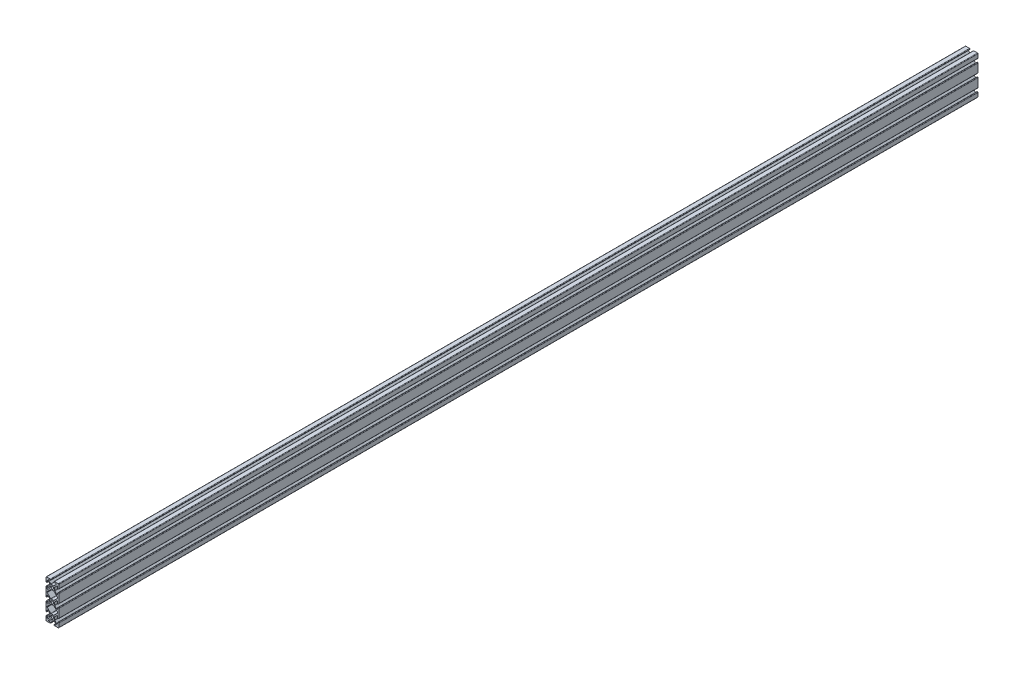
from build123d import *

# Parameters (mm, degrees)
SKETCH1_R            = 2.6035
MAIN_EXTRUSION_DEPTH = 914.4


with BuildPart() as part:
    # Sketch1 → Main Extrusion (new, symmetric)
    with BuildSketch(Plane.XY):
        with BuildLine():
            Line((-12.7, 37.084), (-12.7, 29.6672))
            ThreePointArc((-12.7, 29.6672), (-12.40242049, 28.94877951), (-11.684, 28.6512))
            Line((-11.684, 28.6512), (-11.5062, 28.6512))
            ThreePointArc((-11.5062, 28.6512), (-10.78777951, 28.94877951), (-10.4902, 29.6672))
            Line((-10.4902, 29.6672), (-10.4902, 31.874794456))
            ThreePointArc((-10.4902, 31.874794456), (-9.863006367, 32.813456061), (-8.75577951, 32.593214945))
            Line((-8.75577951, 32.593214945), (-4.81877951, 28.656214945))
            ThreePointArc((-4.81877951, 28.656214945), (-4.598538395, 28.326600823), (-4.5212, 27.937794456))
            Line((-4.5212, 27.937794456), (-4.5212, 22.862205544))
            ThreePointArc((-4.5212, 22.862205544), (-4.598538395, 22.473399177), (-4.81877951, 22.143785055))
            Line((-4.81877951, 22.143785055), (-8.75577951, 18.206785055))
            ThreePointArc((-8.75577951, 18.206785055), (-9.863006367, 17.986543939), (-10.4902, 18.925205544))
            Line((-10.4902, 18.925205544), (-10.4902, 21.1328))
            ThreePointArc((-10.4902, 21.1328), (-10.78777951, 21.85122049), (-11.5062, 22.1488))
            Line((-11.5062, 22.1488), (-11.684, 22.1488))
            ThreePointArc((-11.684, 22.1488), (-12.40242049, 21.85122049), (-12.7, 21.1328))
            Line((-12.7, 21.1328), (-12.7, 4.2672))
            ThreePointArc((-12.7, 4.2672), (-12.40242049, 3.54877951), (-11.684, 3.2512))
            Line((-11.684, 3.2512), (-11.5062, 3.2512))
            ThreePointArc((-11.5062, 3.2512), (-10.78777951, 3.54877951), (-10.4902, 4.2672))
            Line((-10.4902, 4.2672), (-10.4902, 6.474794456))
            ThreePointArc((-10.4902, 6.474794456), (-9.863006367, 7.413456061), (-8.75577951, 7.193214945))
            Line((-8.75577951, 7.193214945), (-4.81877951, 3.256214945))
            ThreePointArc((-4.81877951, 3.256214945), (-4.598538395, 2.926600823), (-4.5212, 2.537794456))
            Line((-4.5212, 2.537794456), (-4.5212, -2.537794456))
            ThreePointArc((-4.5212, -2.537794456), (-4.598538395, -2.926600823), (-4.81877951, -3.256214945))
            Line((-4.81877951, -3.256214945), (-8.75577951, -7.193214945))
            ThreePointArc((-8.75577951, -7.193214945), (-9.863006367, -7.413456061), (-10.4902, -6.474794456))
            Line((-10.4902, -6.474794456), (-10.4902, -4.2672))
            ThreePointArc((-10.4902, -4.2672), (-10.78777951, -3.54877951), (-11.5062, -3.2512))
            Line((-11.5062, -3.2512), (-11.684, -3.2512))
            ThreePointArc((-11.684, -3.2512), (-12.40242049, -3.54877951), (-12.7, -4.2672))
            Line((-12.7, -4.2672), (-12.7, -21.1328))
            ThreePointArc((-12.7, -21.1328), (-12.40242049, -21.85122049), (-11.684, -22.1488))
            Line((-11.684, -22.1488), (-11.5062, -22.1488))
            ThreePointArc((-11.5062, -22.1488), (-10.78777951, -21.85122049), (-10.4902, -21.1328))
            Line((-10.4902, -21.1328), (-10.4902, -18.925205544))
            ThreePointArc((-10.4902, -18.925205544), (-9.863006367, -17.986543939), (-8.75577951, -18.206785055))
            Line((-8.75577951, -18.206785055), (-4.81877951, -22.143785055))
            ThreePointArc((-4.81877951, -22.143785055), (-4.598538395, -22.473399177), (-4.5212, -22.862205544))
            Line((-4.5212, -22.862205544), (-4.5212, -27.937794456))
            ThreePointArc((-4.5212, -27.937794456), (-4.598538395, -28.326600823), (-4.81877951, -28.656214945))
            Line((-4.81877951, -28.656214945), (-8.75577951, -32.593214945))
            ThreePointArc((-8.75577951, -32.593214945), (-9.863006367, -32.813456061), (-10.4902, -31.874794456))
            Line((-10.4902, -31.874794456), (-10.4902, -29.6672))
            ThreePointArc((-10.4902, -29.6672), (-10.78777951, -28.94877951), (-11.5062, -28.6512))
            Line((-11.5062, -28.6512), (-11.684, -28.6512))
            ThreePointArc((-11.684, -28.6512), (-12.40242049, -28.94877951), (-12.7, -29.6672))
            Line((-12.7, -29.6672), (-12.7, -37.084))
            ThreePointArc((-12.7, -37.084), (-12.40242049, -37.80242049), (-11.684, -38.1))
            Line((-11.684, -38.1), (-4.2672, -38.1))
            ThreePointArc((-4.2672, -38.1), (-3.54877951, -37.80242049), (-3.2512, -37.084))
            Line((-3.2512, -37.084), (-3.2512, -36.9062))
            ThreePointArc((-3.2512, -36.9062), (-3.54877951, -36.18777951), (-4.2672, -35.8902))
            Line((-4.2672, -35.8902), (-6.474794456, -35.8902))
            ThreePointArc((-6.474794456, -35.8902), (-7.413456061, -35.263006367), (-7.193214945, -34.15577951))
            Line((-7.193214945, -34.15577951), (-3.256214945, -30.21877951))
            ThreePointArc((-3.256214945, -30.21877951), (-2.926600823, -29.998538395), (-2.537794456, -29.9212))
            Line((-2.537794456, -29.9212), (2.537794456, -29.9212))
            ThreePointArc((2.537794456, -29.9212), (2.926600823, -29.998538395), (3.256214945, -30.21877951))
            Line((3.256214945, -30.21877951), (7.193214945, -34.15577951))
            ThreePointArc((7.193214945, -34.15577951), (7.413456061, -35.263006367), (6.474794456, -35.8902))
            Line((6.474794456, -35.8902), (4.2672, -35.8902))
            ThreePointArc((4.2672, -35.8902), (3.54877951, -36.18777951), (3.2512, -36.9062))
            Line((3.2512, -36.9062), (3.2512, -37.084))
            ThreePointArc((3.2512, -37.084), (3.54877951, -37.80242049), (4.2672, -38.1))
            Line((4.2672, -38.1), (11.684, -38.1))
            ThreePointArc((11.684, -38.1), (12.40242049, -37.80242049), (12.7, -37.084))
            Line((12.7, -37.084), (12.7, -29.6672))
            ThreePointArc((12.7, -29.6672), (12.40242049, -28.94877951), (11.684, -28.6512))
            Line((11.684, -28.6512), (11.5062, -28.6512))
            ThreePointArc((11.5062, -28.6512), (10.78777951, -28.94877951), (10.4902, -29.6672))
            Line((10.4902, -29.6672), (10.4902, -31.874794456))
            ThreePointArc((10.4902, -31.874794456), (9.863006367, -32.813456061), (8.75577951, -32.593214945))
            Line((8.75577951, -32.593214945), (4.81877951, -28.656214945))
            ThreePointArc((4.81877951, -28.656214945), (4.598538395, -28.326600823), (4.5212, -27.937794456))
            Line((4.5212, -27.937794456), (4.5212, -22.862205544))
            ThreePointArc((4.5212, -22.862205544), (4.598538395, -22.473399177), (4.81877951, -22.143785055))
            Line((4.81877951, -22.143785055), (8.75577951, -18.206785055))
            ThreePointArc((8.75577951, -18.206785055), (9.863006367, -17.986543939), (10.4902, -18.925205544))
            Line((10.4902, -18.925205544), (10.4902, -21.1328))
            ThreePointArc((10.4902, -21.1328), (10.78777951, -21.85122049), (11.5062, -22.1488))
            Line((11.5062, -22.1488), (11.684, -22.1488))
            ThreePointArc((11.684, -22.1488), (12.40242049, -21.85122049), (12.7, -21.1328))
            Line((12.7, -21.1328), (12.7, -4.2672))
            ThreePointArc((12.7, -4.2672), (12.40242049, -3.54877951), (11.684, -3.2512))
            Line((11.684, -3.2512), (11.5062, -3.2512))
            ThreePointArc((11.5062, -3.2512), (10.78777951, -3.54877951), (10.4902, -4.2672))
            Line((10.4902, -4.2672), (10.4902, -6.474794456))
            ThreePointArc((10.4902, -6.474794456), (9.863006367, -7.413456061), (8.75577951, -7.193214945))
            Line((8.75577951, -7.193214945), (4.81877951, -3.256214945))
            ThreePointArc((4.81877951, -3.256214945), (4.598538395, -2.926600823), (4.5212, -2.537794456))
            Line((4.5212, -2.537794456), (4.5212, 2.537794456))
            ThreePointArc((4.5212, 2.537794456), (4.598538395, 2.926600823), (4.81877951, 3.256214945))
            Line((4.81877951, 3.256214945), (8.75577951, 7.193214945))
            ThreePointArc((8.75577951, 7.193214945), (9.863006367, 7.413456061), (10.4902, 6.474794456))
            Line((10.4902, 6.474794456), (10.4902, 4.2672))
            ThreePointArc((10.4902, 4.2672), (10.78777951, 3.54877951), (11.5062, 3.2512))
            Line((11.5062, 3.2512), (11.684, 3.2512))
            ThreePointArc((11.684, 3.2512), (12.40242049, 3.54877951), (12.7, 4.2672))
            Line((12.7, 4.2672), (12.7, 21.1328))
            ThreePointArc((12.7, 21.1328), (12.40242049, 21.85122049), (11.684, 22.1488))
            Line((11.684, 22.1488), (11.5062, 22.1488))
            ThreePointArc((11.5062, 22.1488), (10.78777951, 21.85122049), (10.4902, 21.1328))
            Line((10.4902, 21.1328), (10.4902, 18.925205544))
            ThreePointArc((10.4902, 18.925205544), (9.863006367, 17.986543939), (8.75577951, 18.206785055))
            Line((8.75577951, 18.206785055), (4.81877951, 22.143785055))
            ThreePointArc((4.81877951, 22.143785055), (4.598538395, 22.473399177), (4.5212, 22.862205544))
            Line((4.5212, 22.862205544), (4.5212, 27.937794456))
            ThreePointArc((4.5212, 27.937794456), (4.598538395, 28.326600823), (4.81877951, 28.656214945))
            Line((4.81877951, 28.656214945), (8.75577951, 32.593214945))
            ThreePointArc((8.75577951, 32.593214945), (9.863006367, 32.813456061), (10.4902, 31.874794456))
            Line((10.4902, 31.874794456), (10.4902, 29.6672))
            ThreePointArc((10.4902, 29.6672), (10.78777951, 28.94877951), (11.5062, 28.6512))
            Line((11.5062, 28.6512), (11.684, 28.6512))
            ThreePointArc((11.684, 28.6512), (12.40242049, 28.94877951), (12.7, 29.6672))
            Line((12.7, 29.6672), (12.7, 37.084))
            ThreePointArc((12.7, 37.084), (12.40242049, 37.80242049), (11.684, 38.1))
            Line((11.684, 38.1), (4.2672, 38.1))
            ThreePointArc((4.2672, 38.1), (3.54877951, 37.80242049), (3.2512, 37.084))
            Line((3.2512, 37.084), (3.2512, 36.9062))
            ThreePointArc((3.2512, 36.9062), (3.54877951, 36.18777951), (4.2672, 35.8902))
            Line((4.2672, 35.8902), (6.474794456, 35.8902))
            ThreePointArc((6.474794456, 35.8902), (7.413456061, 35.263006367), (7.193214945, 34.15577951))
            Line((7.193214945, 34.15577951), (3.256214945, 30.21877951))
            ThreePointArc((3.256214945, 30.21877951), (2.926600823, 29.998538395), (2.537794456, 29.9212))
            Line((2.537794456, 29.9212), (-2.537794456, 29.9212))
            ThreePointArc((-2.537794456, 29.9212), (-2.926600823, 29.998538395), (-3.256214945, 30.21877951))
            Line((-3.256214945, 30.21877951), (-7.193214945, 34.15577951))
            ThreePointArc((-7.193214945, 34.15577951), (-7.413456061, 35.263006367), (-6.474794456, 35.8902))
            Line((-6.474794456, 35.8902), (-4.2672, 35.8902))
            ThreePointArc((-4.2672, 35.8902), (-3.54877951, 36.18777951), (-3.2512, 36.9062))
            Line((-3.2512, 36.9062), (-3.2512, 37.084))
            ThreePointArc((-3.2512, 37.084), (-3.54877951, 37.80242049), (-4.2672, 38.1))
            Line((-4.2672, 38.1), (-11.684, 38.1))
            ThreePointArc((-11.684, 38.1), (-12.40242049, 37.80242049), (-12.7, 37.084))
        make_face()
        with Locations((0, 25.4)):
            Circle(SKETCH1_R, mode=Mode.SUBTRACT)
        Circle(SKETCH1_R, mode=Mode.SUBTRACT)
        with Locations((0, -25.4)):
            Circle(SKETCH1_R, mode=Mode.SUBTRACT)
        with BuildLine():
            Line((-10.4902, 12.473605544), (-10.4902, 12.926394456))
            ThreePointArc((-10.4902, 12.926394456), (-10.412861605, 13.315200823), (-10.19262049, 13.644814945))
            Line((-10.19262049, 13.644814945), (-3.256214945, 20.58122049))
            ThreePointArc((-3.256214945, 20.58122049), (-2.926600823, 20.801461605), (-2.537794456, 20.8788))
            Line((-2.537794456, 20.8788), (2.537794456, 20.8788))
            ThreePointArc((2.537794456, 20.8788), (2.926600823, 20.801461605), (3.256214945, 20.58122049))
            Line((3.256214945, 20.58122049), (10.19262049, 13.644814945))
            ThreePointArc((10.19262049, 13.644814945), (10.412861605, 13.315200823), (10.4902, 12.926394456))
            Line((10.4902, 12.926394456), (10.4902, 12.473605544))
            ThreePointArc((10.4902, 12.473605544), (10.412861605, 12.084799177), (10.19262049, 11.755185055))
            Line((10.19262049, 11.755185055), (3.256214945, 4.81877951))
            ThreePointArc((3.256214945, 4.81877951), (2.926600823, 4.598538395), (2.537794456, 4.5212))
            Line((2.537794456, 4.5212), (-2.537794456, 4.5212))
            ThreePointArc((-2.537794456, 4.5212), (-2.926600823, 4.598538395), (-3.256214945, 4.81877951))
            Line((-3.256214945, 4.81877951), (-10.19262049, 11.755185055))
            ThreePointArc((-10.19262049, 11.755185055), (-10.412861605, 12.084799177), (-10.4902, 12.473605544))
        make_face(mode=Mode.SUBTRACT)
        with BuildLine():
            Line((-2.537794456, -4.5212), (2.537794456, -4.5212))
            ThreePointArc((2.537794456, -4.5212), (2.926600823, -4.598538395), (3.256214945, -4.81877951))
            Line((3.256214945, -4.81877951), (10.19262049, -11.755185055))
            ThreePointArc((10.19262049, -11.755185055), (10.412861605, -12.084799177), (10.4902, -12.473605544))
            Line((10.4902, -12.473605544), (10.4902, -12.926394456))
            ThreePointArc((10.4902, -12.926394456), (10.412861605, -13.315200823), (10.19262049, -13.644814945))
            Line((10.19262049, -13.644814945), (3.256214945, -20.58122049))
            ThreePointArc((3.256214945, -20.58122049), (2.926600823, -20.801461605), (2.537794456, -20.8788))
            Line((2.537794456, -20.8788), (-2.537794456, -20.8788))
            ThreePointArc((-2.537794456, -20.8788), (-2.926600823, -20.801461605), (-3.256214945, -20.58122049))
            Line((-3.256214945, -20.58122049), (-10.19262049, -13.644814945))
            ThreePointArc((-10.19262049, -13.644814945), (-10.412861605, -13.315200823), (-10.4902, -12.926394456))
            Line((-10.4902, -12.926394456), (-10.4902, -12.473605544))
            ThreePointArc((-10.4902, -12.473605544), (-10.412861605, -12.084799177), (-10.19262049, -11.755185055))
            Line((-10.19262049, -11.755185055), (-3.256214945, -4.81877951))
            ThreePointArc((-3.256214945, -4.81877951), (-2.926600823, -4.598538395), (-2.537794456, -4.5212))
        make_face(mode=Mode.SUBTRACT)
    extrude(amount=MAIN_EXTRUSION_DEPTH, both=True)


solid = part.part
